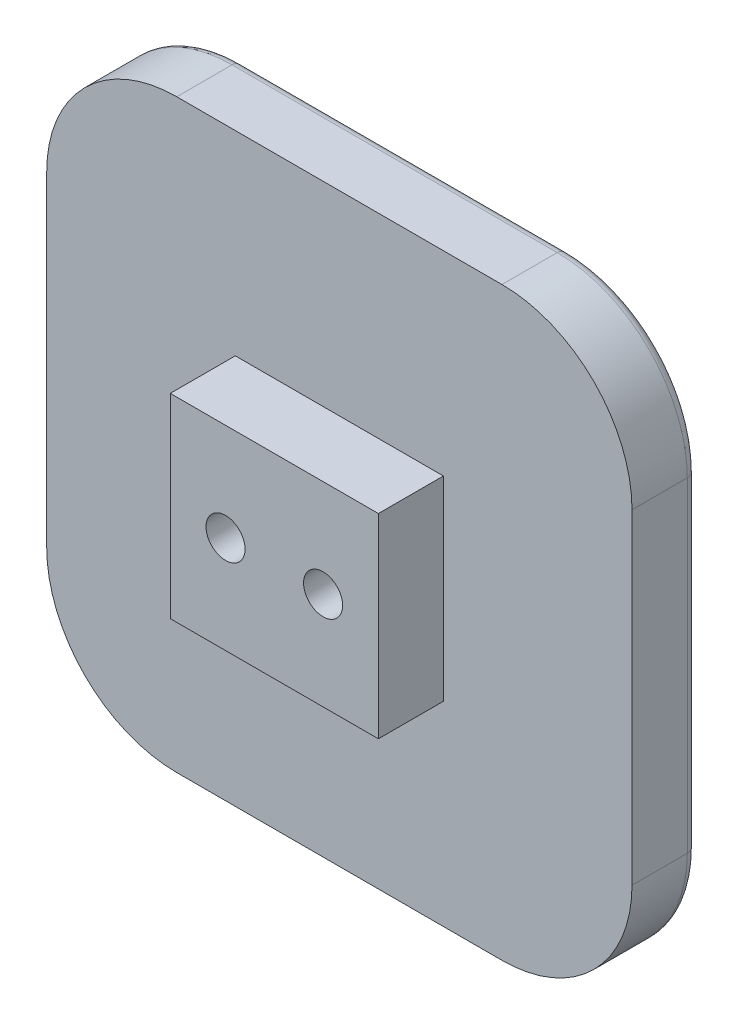
from build123d import *

# Parameters (mm, degrees)
Y_KSEKLIK_EKSTR_ZYON1_DEPTH = 20
CUT_EXTRUDE1_DEPTH          = 44
CUT_EXTRUDE1_DEPTH_BACK     = 10
SKETCH1_R                   = 2.5
SKETCH2_W                   = 32
SKETCH2_H                   = 30
CUT_EXTRUDE3_DEPTH          = 27
SKETCH3_W                   = 32
SKETCH3_H                   = 30
BOSS_EXTRUDE1_DEPTH         = 16
CUT_EXTRUDE4_DEPTH          = 4
SKETCH5_W                   = 33.515954684
SKETCH5_H                   = 18.308274805
BOSS_EXTRUDE2_DEPTH         = 10
CUT_EXTRUDE5_DEPTH          = 53
CUT_EXTRUDE5_DEPTH_BACK     = 25
SKETCH6_R                   = 2.5
SKETCH7_W                   = 36.495036791
SKETCH7_H                   = 91.485439351
SKETCH7_W_2                 = 38.306268879
CUT_EXTRUDE7_DEPTH          = 30
SKETCH8_W                   = 29
SKETCH8_H                   = 90
BOSS_EXTRUDE3_DEPTH         = 10
CUT_EXTRUDE8_DEPTH          = 10
SKETCH10_W                  = 32
SKETCH10_H                  = 30
CUT_EXTRUDE9_DEPTH          = 28
SKETCH11_W                  = 32
SKETCH11_H                  = 30
BOSS_EXTRUDE4_DEPTH         = 10
SKETCH12_R                  = 3
CUT_EXTRUDE10_DEPTH         = 22
SKETCH13_R                  = 6
CUT_EXTRUDE11_DEPTH         = 5
FILLET1_R                   = 1.5


with BuildPart() as part:
    # Çizim1 → Yükseklik-Ekstrüzyon1 (new body)
    with BuildSketch(Plane.XY):
        with BuildLine():
            Line((-41.541366964, -1.110887656), (-41.541366964, 48.889112344))
            ThreePointArc((-41.541366964, 48.889112344), (-35.683502588, 63.031247968), (-21.541366964, 68.889112344))
            Line((-21.541366964, 68.889112344), (28.458633036, 68.889112344))
            ThreePointArc((28.458633036, 68.889112344), (42.600768659, 63.031247968), (48.458633036, 48.889112344))
            Line((48.458633036, 48.889112344), (48.458633036, -1.110887656))
            ThreePointArc((48.458633036, -1.110887656), (42.600768659, -15.25302328), (28.458633036, -21.110887656))
            Line((28.458633036, -21.110887656), (-21.541366964, -21.110887656))
            ThreePointArc((-21.541366964, -21.110887656), (-35.683502588, -15.25302328), (-41.541366964, -1.110887656))
        make_face()
    extrude(amount=Y_KSEKLIK_EKSTR_ZYON1_DEPTH)

    # Sketch1 → Cut-Extrude1 (cut, two sides: drawn at the far end of the back side and taken through both)
    with BuildSketch(Plane.XY.offset(-CUT_EXTRUDE1_DEPTH_BACK)):
        with Locations(Location((-4.041366964, 23.889112344, 0), (0, 0, 180))):
            Circle(SKETCH1_R)
        with Locations(Location((10.958633036, 23.889112344, 0), (0, 0, 180))):
            Circle(SKETCH1_R)
    extrude(amount=CUT_EXTRUDE1_DEPTH + CUT_EXTRUDE1_DEPTH_BACK, mode=Mode.SUBTRACT)

    # Sketch2 → Cut-Extrude3 (cut)
    with BuildSketch(Plane.XY):
        with Locations((3.458633036, 53.889112344)):
            Rectangle(SKETCH2_W, SKETCH2_H)
    extrude(amount=CUT_EXTRUDE3_DEPTH, mode=Mode.SUBTRACT)

    # Sketch3 → Boss-Extrude1 (add)
    with BuildSketch(Plane.XY):
        with Locations((3.458633036, 53.889112344)):
            Rectangle(SKETCH3_W, SKETCH3_H)
    extrude(amount=BOSS_EXTRUDE1_DEPTH)

    # Sketch4 → Cut-Extrude4 (cut)
    with BuildSketch(Plane.XY):
        Polygon((15.692905243, 23.889112344), (13.325769139, 27.989112344), (8.591496932, 27.989112344), (6.224360828, 23.889112344), (8.591496932, 19.789112344), (13.325769139, 19.789112344), align=None)
        Polygon((0.692905243, 23.889112344), (-1.674230861, 27.989112344), (-6.408503068, 27.989112344), (-8.775639172, 23.889112344), (-6.408503068, 19.789112344), (-1.674230861, 19.789112344), align=None)
    extrude(amount=CUT_EXTRUDE4_DEPTH, mode=Mode.SUBTRACT)

    # Sketch5 → Boss-Extrude2 (add)
    with BuildSketch(Plane.XY):
        with Locations((2.203630327, 23.667641278)):
            Rectangle(SKETCH5_W, SKETCH5_H)
    extrude(amount=BOSS_EXTRUDE2_DEPTH)

    # Sketch6 → Cut-Extrude5 (cut, two sides: drawn at the far end of the back side and taken through both)
    with BuildSketch(Plane.XY.offset(-CUT_EXTRUDE5_DEPTH_BACK)):
        with Locations(Location((-4.041366964, 23.889112344, 0), (0, 0, 180))):
            Circle(SKETCH6_R)
        with Locations(Location((10.958633036, 23.889112344, 0), (0, 0, 180))):
            Circle(SKETCH6_R)
    extrude(amount=CUT_EXTRUDE5_DEPTH + CUT_EXTRUDE5_DEPTH_BACK, mode=Mode.SUBTRACT)

    # Sketch7 → Cut-Extrude7 (cut)
    with BuildSketch(Plane.XY):
        with Locations((-30.78888536, 23.146392668)):
            Rectangle(SKETCH7_W, SKETCH7_H)
        with Locations((38.611767476, 23.146392668)):
            Rectangle(SKETCH7_W_2, SKETCH7_H)
    extrude(amount=CUT_EXTRUDE7_DEPTH, mode=Mode.SUBTRACT)

    # Sketch8 → Boss-Extrude3 (add)
    with BuildSketch(Plane.XY):
        with Locations((-27.041366964, 23.889112344)):
            Rectangle(SKETCH8_W, SKETCH8_H)
        with Locations((33.958633036, 23.889112344)):
            Rectangle(SKETCH8_W, SKETCH8_H)
    extrude(amount=BOSS_EXTRUDE3_DEPTH)

    # Sketch9 → Cut-Extrude8 (cut)
    with BuildSketch(Plane.XY):
        with BuildLine():
            Line((-41.541366964, 68.889112344), (-21.541366964, 68.889112344))
            ThreePointArc((-21.541366964, 68.889112344), (-35.683502588, 63.031247968), (-41.541366964, 48.889112344))
            Line((-41.541366964, 48.889112344), (-41.541366964, 68.889112344))
        make_face()
        with BuildLine():
            Line((48.458633036, 68.889112344), (48.458633036, 48.889112344))
            ThreePointArc((48.458633036, 48.889112344), (42.600768659, 63.031247968), (28.458633036, 68.889112344))
            Line((28.458633036, 68.889112344), (48.458633036, 68.889112344))
        make_face()
        with BuildLine():
            Line((48.458633036, -21.110887656), (28.458633036, -21.110887656))
            ThreePointArc((28.458633036, -21.110887656), (42.600768659, -15.25302328), (48.458633036, -1.110887656))
            Line((48.458633036, -1.110887656), (48.458633036, -21.110887656))
        make_face()
        with BuildLine():
            Line((-41.541366964, -21.110887656), (-41.541366964, -1.110887656))
            ThreePointArc((-41.541366964, -1.110887656), (-35.683502588, -15.25302328), (-21.541366964, -21.110887656))
            Line((-21.541366964, -21.110887656), (-41.541366964, -21.110887656))
        make_face()
    extrude(amount=CUT_EXTRUDE8_DEPTH, mode=Mode.SUBTRACT)

    # Sketch10 → Cut-Extrude9 (cut)
    with BuildSketch(Plane.XY):
        with Locations((3.458633036, 53.889112344)):
            Rectangle(SKETCH10_W, SKETCH10_H)
        with Locations((3.458633036, -6.110887656)):
            Rectangle(SKETCH10_W, SKETCH10_H)
    extrude(amount=CUT_EXTRUDE9_DEPTH, mode=Mode.SUBTRACT)

    # Sketch11 → Boss-Extrude4 (add)
    with BuildSketch(Plane.XY):
        with Locations((3.458633036, 53.889112344)):
            Rectangle(SKETCH11_W, SKETCH11_H)
        with Locations((3.458633036, -6.110887656)):
            Rectangle(SKETCH11_W, SKETCH11_H)
    extrude(amount=BOSS_EXTRUDE4_DEPTH)

    # Sketch12 → Cut-Extrude10 (cut)
    with BuildSketch(Plane.XY):
        with Locations(Location((-4.041366964, 23.889112344, 0), (0, 0, 180))):
            Circle(SKETCH12_R)
        with Locations(Location((10.958633036, 23.889112344, 0), (0, 0, 180))):
            Circle(SKETCH12_R)
    extrude(amount=CUT_EXTRUDE10_DEPTH, mode=Mode.SUBTRACT)

    # Sketch13 → Cut-Extrude11 (cut)
    with BuildSketch(Plane.XY):
        with Locations((10.958633036, 23.889112344)):
            Circle(SKETCH13_R)
        with Locations((-4.041366964, 23.889112344)):
            Circle(SKETCH13_R)
    extrude(amount=CUT_EXTRUDE11_DEPTH, mode=Mode.SUBTRACT)

    # Fillet1
    fillet1_edges = [part.edges().sort_by_distance(p)[0] for p in [
        (-41.541366964, 23.889112344, 0),
        (-35.683502588, 63.031247968, 0),
        (3.458633036, 68.889112344, 0),
        (42.600768659, 63.031247968, 0),
        (48.458633036, 23.889112344, 0),
        (42.600768659, -15.25302328, 0),
        (3.458633036, -21.110887656, 0),
        (-35.683502588, -15.25302328, 0),
    ]]
    fillet(fillet1_edges, radius=FILLET1_R)


solid = part.part
